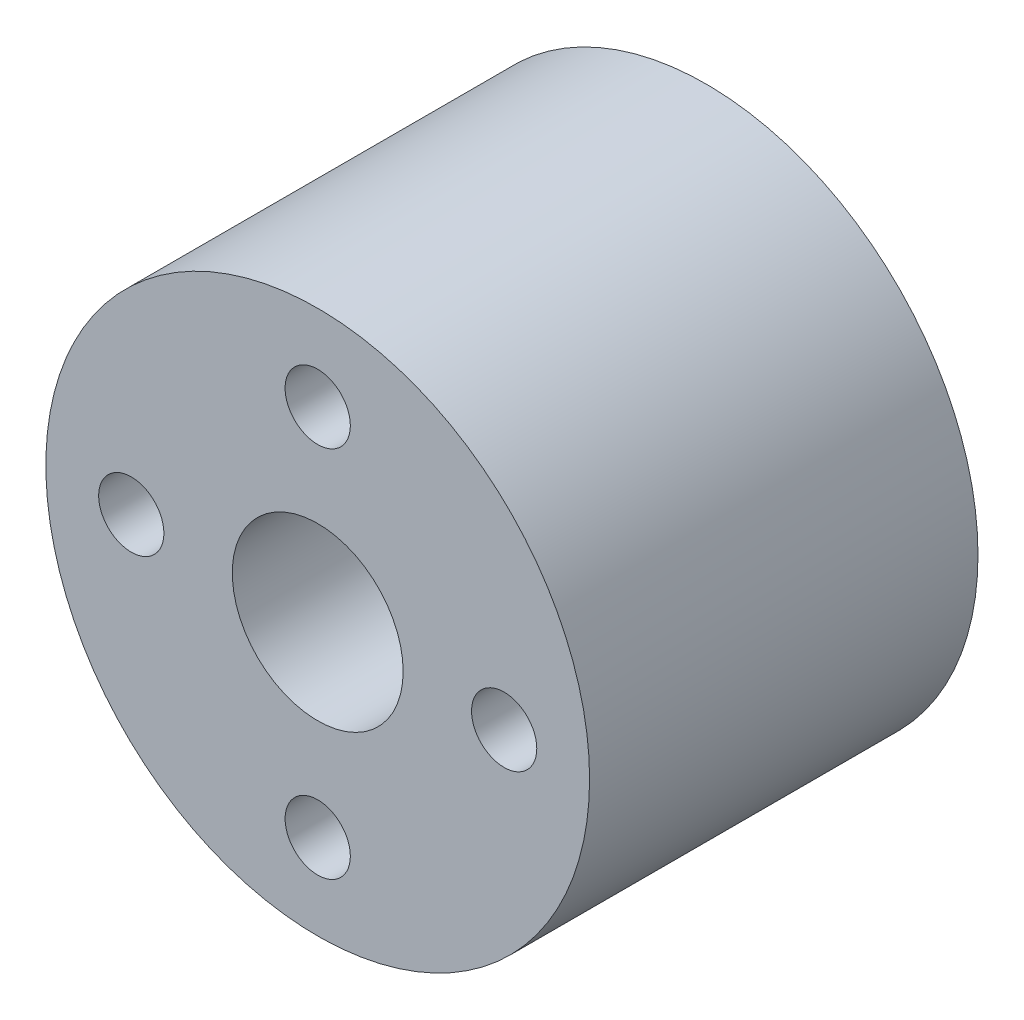
from build123d import *

# Parameters (mm, degrees)
SKETCH1_R           = 60
SKETCH1_R_2         = 5.5
SKETCH1_R_3         = 9
BOSS_EXTRUDE1_DEPTH = 25
CUT_EXTRUDE7_REACH  = 90.459
SKETCH6_R           = 2.1
CIRPATTERN4_COUNT   = 4
SKETCH2_R           = 63
SKETCH2_R_2         = 60
BOSS_EXTRUDE2_DEPTH = 300
SKETCH3_R           = 11.04
CUT_EXTRUDE1_DEPTH  = 10
CUT_EXTRUDE2_REACH  = 314.95
SKETCH4_R           = 1.5
CIRPATTERN1_COUNT   = 4
CUT_EXTRUDE3_DEPTH  = 3
CIRPATTERN2_COUNT   = 4
SKETCH7_OUTSIDE_W   = 197.786
SKETCH7_OUTSIDE_H   = 197.786
SKETCH7_OUTSIDE_R   = 17.5
CUT_EXTRUDE8_DEPTH  = 313.950475315


with BuildPart() as part:
    # Sketch1 → Boss-Extrude1 (new body)
    with BuildSketch(Plane.XY):
        Circle(SKETCH1_R)
        with Locations((25, 0)):
            Circle(SKETCH1_R_2, mode=Mode.SUBTRACT)
        with Locations((-25, 0)):
            Circle(SKETCH1_R_3, mode=Mode.SUBTRACT)
    extrude(amount=-BOSS_EXTRUDE1_DEPTH)

    # Sketch6 → Cut-Extrude7 (cut, up to next)
    with BuildSketch(Plane.XY, mode=Mode.PRIVATE) as cut_extrude7_sk1:
        with Locations((25, 12)):
            Circle(SKETCH6_R)
    cut_extrude7_tool1 = extrude(cut_extrude7_sk1.sketch, amount=-CUT_EXTRUDE7_REACH, mode=Mode.PRIVATE) & part.part
    cut_extrude7 = cut_extrude7_tool1.solids().sort_by_distance((25, 12, 0))[0]
    add(cut_extrude7, mode=Mode.SUBTRACT)

    # CirPattern4: Cut-Extrude7 ×4 about axis
    cirpattern4_axis = Axis((25, 0, 0), (0, 0, 1))
    for i in range(1, CIRPATTERN4_COUNT):
        add(cut_extrude7.rotate(cirpattern4_axis, i * 360 / CIRPATTERN4_COUNT), mode=Mode.SUBTRACT)

    # Sketch2 → Boss-Extrude2 (add)
    with BuildSketch(Plane.XY):
        Circle(SKETCH2_R)
        Circle(SKETCH2_R_2, mode=Mode.SUBTRACT)
    extrude(amount=-BOSS_EXTRUDE2_DEPTH)

    # Sketch3 → Cut-Extrude1 (cut)
    with BuildSketch(Plane(origin=(0, 0, -25), x_dir=(-1, 0, 0), z_dir=(0, 0, -1))):
        with Locations((25, 0)):
            Circle(SKETCH3_R)
    extrude(amount=-CUT_EXTRUDE1_DEPTH, mode=Mode.SUBTRACT)

    # Sketch4 → Cut-Extrude2 (cut, up to next)
    with BuildSketch(Plane.XY, mode=Mode.PRIVATE) as cut_extrude2_sk1:
        with Locations((-39, 0)):
            Circle(SKETCH4_R)
    cut_extrude2_tool1 = extrude(cut_extrude2_sk1.sketch, amount=-CUT_EXTRUDE2_REACH, mode=Mode.PRIVATE) & part.part
    cut_extrude2 = cut_extrude2_tool1.solids().sort_by_distance((-39, 0, 0))[0]
    add(cut_extrude2, mode=Mode.SUBTRACT)

    # CirPattern1: Cut-Extrude2 ×4 about axis
    cirpattern1_axis = Axis((-25, 0, 0), (0, 0, 1))
    for i in range(1, CIRPATTERN1_COUNT):
        add(cut_extrude2.rotate(cirpattern1_axis, i * 360 / CIRPATTERN1_COUNT), mode=Mode.SUBTRACT)

    # Sketch5 → Cut-Extrude3 (cut)
    with BuildSketch(Plane.XY):
        Polygon((-12.732050808, -3), (-9.267949192, -3), (-7.535898385, 0), (-9.267949192, 3), (-12.732050808, 3), (-14.464101615, 0), align=None)
    cut_extrude3 = extrude(amount=-CUT_EXTRUDE3_DEPTH, mode=Mode.SUBTRACT)

    # CirPattern2: Cut-Extrude3 ×4 about axis
    cirpattern2_axis = Axis((-25, 0, 0), (0, 0, 1))
    for i in range(1, CIRPATTERN2_COUNT):
        add(cut_extrude3.rotate(cirpattern2_axis, i * 360 / CIRPATTERN2_COUNT), mode=Mode.SUBTRACT)

    # Sketch7 outside → Cut-Extrude8 (cut, through all)
    with BuildSketch(Plane.XY):
        Rectangle(SKETCH7_OUTSIDE_W, SKETCH7_OUTSIDE_H)
        with Locations((25, 0)):
            Circle(SKETCH7_OUTSIDE_R, mode=Mode.SUBTRACT)
    extrude(amount=-CUT_EXTRUDE8_DEPTH, mode=Mode.SUBTRACT)


solid = part.part
